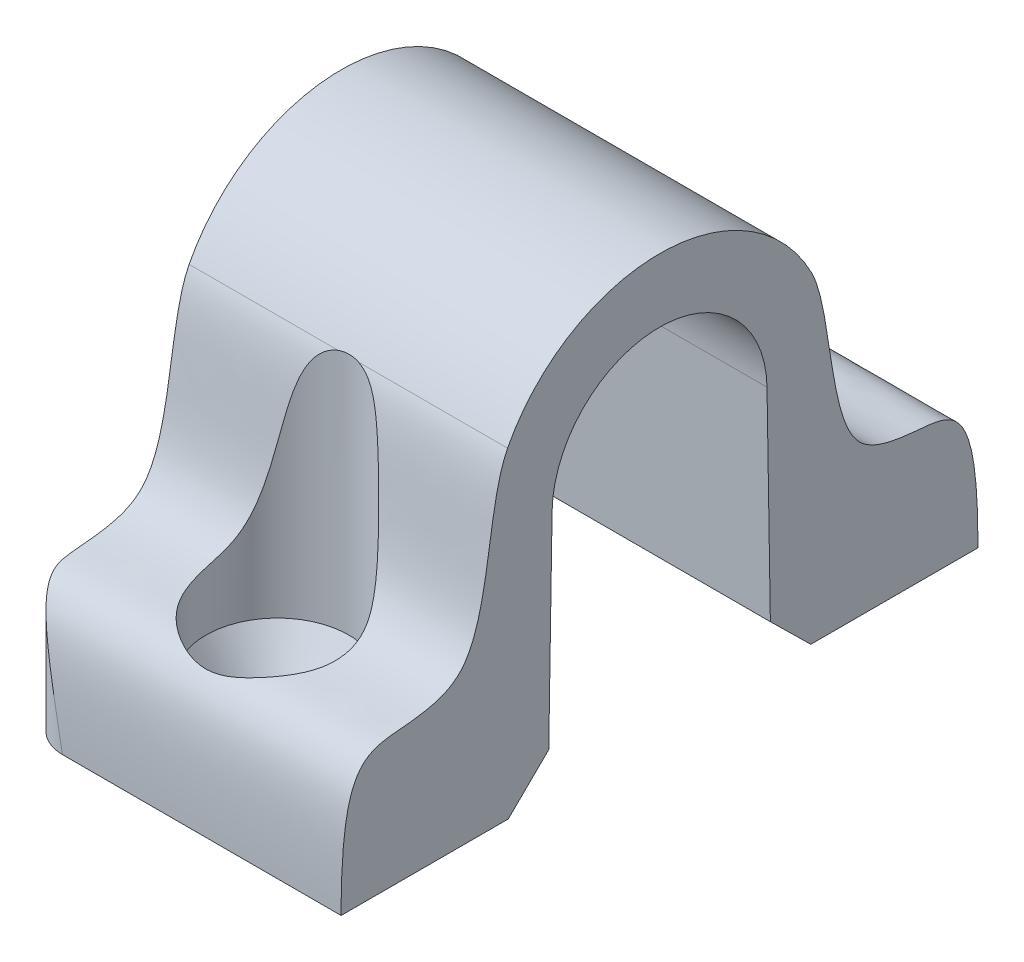
from build123d import *

# Parameters (mm, degrees)
BOSS_EXTRUDE1_DEPTH      = 10
BOSS_EXTRUDE1_DEPTH_BACK = 10
CUT_EXTRUDE1_DEPTH       = 35.292856562


with BuildPart() as part:
    # Sketch1 → Boss-Extrude1 (new, two sides: drawn at the far end of the back side and taken through both)
    with BuildSketch(Plane(origin=(0, 0, 0), x_dir=(0, 0, -1), z_dir=(1, 0, 0)).offset(-BOSS_EXTRUDE1_DEPTH_BACK)):
        with BuildLine():
            Line((-20, 0), (-9.5, 0))
            Line((-9.5, 0), (-6.959169452, 2.499666551))
            Line((-6.959169452, 2.499666551), (-6.749099688, 15.36024248))
            ThreePointArc((-6.749099688, 15.36024248), (0, 22), (6.749099688, 15.36024248))
            Line((6.749099688, 15.36024248), (6.959169452, 2.499666551))
            Line((6.959169452, 2.499666551), (9.5, 0))
            Line((9.5, 0), (20, 0))
            add(Edge.make_bspline(
                [(9.546567927, 20.192220232), (10.857885065, 17.659233529), (10.505968038, 9.891536863), (17.534240818, 7.323509593), (20, 9.812519834), (20, 0)],
                knots=[0, 0, 0, 0, 0.359294203, 0.459294203, 1, 1, 1, 1], degree=3))
            ThreePointArc((9.546567927, 20.192220232), (0, 26), (-9.546567927, 20.192220232))
            add(Edge.make_bspline(
                [(-9.546567927, 20.192220232), (-10.857885065, 17.659233529), (-10.505968038, 9.891536863), (-17.534240818, 7.323509593), (-20, 9.812519834), (-20, 0)],
                knots=[0, 0, 0, 0, 0.359294203, 0.459294203, 1, 1, 1, 1], degree=3))
        make_face()
    extrude(amount=BOSS_EXTRUDE1_DEPTH + BOSS_EXTRUDE1_DEPTH_BACK)

    # Sketch4 → Cut-Revolve1 (revolve, cut)
    with BuildSketch(Plane(origin=(0, 0, 0), x_dir=(0, 0, -1), z_dir=(1, 0, 0))):
        Polygon((-12.1, 1), (-9.5, 5), (-9.5, 20.281152949), (-14, 20.281152949), (-14, 0), (-12.1, 0), align=None)
    cut_revolve1 = revolve(axis=Axis((0, 20.281152949, 14), (0, -1, 0)), mode=Mode.SUBTRACT)

    # Mirror1: Cut-Revolve1 across plane
    add(cut_revolve1.mirror(Plane.XY), mode=Mode.SUBTRACT)

    # Sketch5 → Cut-Extrude1 (cut, through all)
    with BuildSketch(Plane.XZ):
        with BuildLine():
            Line((-7.5, 20), (-10, 20))
            Line((-10, 20), (-10, 17.5))
            ThreePointArc((-10, 17.5), (-9.267766953, 19.267766953), (-7.5, 20))
        make_face()
        with BuildLine():
            Line((-10, -20), (-10, -17.5))
            ThreePointArc((-10, -17.5), (-9.267766953, -19.267766953), (-7.5, -20))
            Line((-7.5, -20), (-10, -20))
        make_face()
    extrude(amount=-CUT_EXTRUDE1_DEPTH, mode=Mode.SUBTRACT)


solid = part.part
